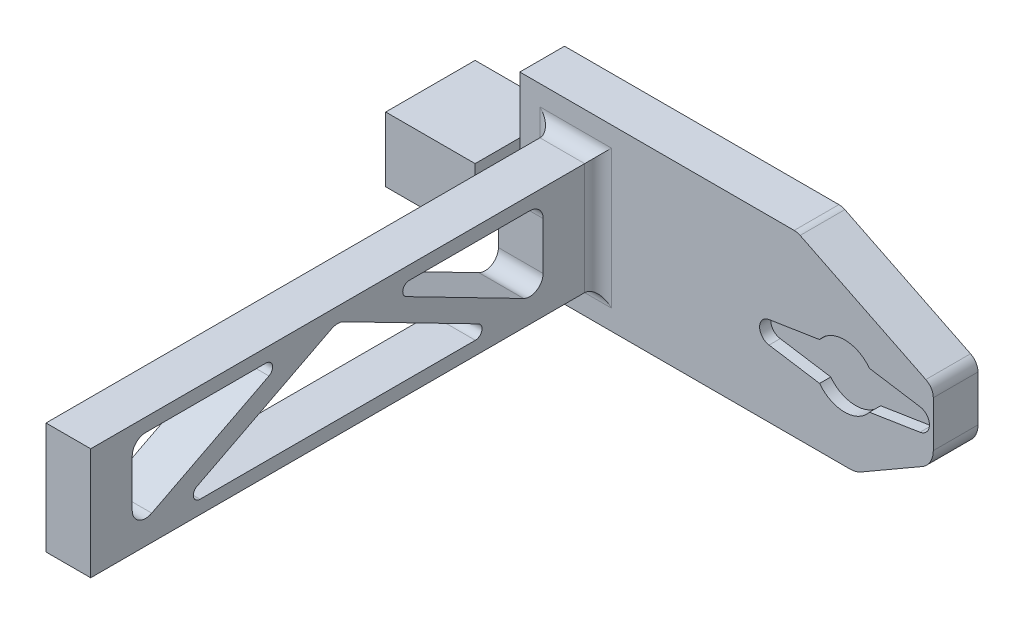
from build123d import *

# Parameters (mm, degrees)
SKETCH3_W            = 42.5
SKETCH3_H            = 15
BOSS_EXTRUDE1_DEPTH  = 10
SKETCH2_R            = 7.012606221
CUT_EXTRUDE1_DEPTH   = 2.5
SKETCH11_W           = 42.5
SKETCH11_H           = 10
BOSS_EXTRUDE5_DEPTH  = 10
SKETCH14_W           = 42.5
SKETCH14_H           = 10
BOSS_EXTRUDE7_DEPTH  = 15
SKETCH20_W           = 10
SKETCH20_H           = 40
BOSS_EXTRUDE10_DEPTH = 50
SKETCH21_W           = 10
SKETCH21_H           = 25
BOSS_EXTRUDE11_DEPTH = 113.5
FILLET1_R            = 3
CHAMFER1_SIZE        = 15
CHAMFER1_SIZE2       = 30.41699103
FILLET2_R            = 3
CHAMFER2_SIZE        = 10
CHAMFER2_SIZE2       = 17.320508076
FILLET3_R            = 5
CUT_EXTRUDE2_DEPTH   = 144.583262507
FILLET4_R            = 3
FILLET5_R            = 1.5
SKETCH25_W           = 10
SKETCH25_H           = 14.5
BOSS_EXTRUDE12_DEPTH = 20
SKETCH26_W           = 20
SKETCH26_H           = 14.5
BOSS_EXTRUDE13_DEPTH = 10


with BuildPart() as part:
    # Sketch3 → Boss-Extrude1 (new body)
    with BuildSketch(Plane.XY):
        with Locations((-1.388845539, 0.05888455)):
            Rectangle(SKETCH3_W, SKETCH3_H)
    extrude(amount=-BOSS_EXTRUDE1_DEPTH)

    # Sketch2 → Cut-Extrude1 (cut)
    with BuildSketch(Plane.XY):
        Circle(SKETCH2_R)
        with BuildLine():
            Line((-16.888114198, 2.469689731), (-3.968626967, 4.5))
            ThreePointArc((-3.968626967, 4.5), (0, 6), (3.968626967, 4.5))
            Line((3.968626967, 4.5), (16.888114198, 2.469689731))
            ThreePointArc((16.888114198, 2.469689731), (19, 0), (16.888114198, -2.469689731))
            Line((16.888114198, -2.469689731), (3.968626967, -4.5))
            ThreePointArc((3.968626967, -4.5), (0, -6), (-3.968626967, -4.5))
            Line((-3.968626967, -4.5), (-16.888114198, -2.469689731))
            ThreePointArc((-16.888114198, -2.469689731), (-19, 0), (-16.888114198, 2.469689731))
        make_face()
    extrude(amount=-CUT_EXTRUDE1_DEPTH, mode=Mode.SUBTRACT)

    # Sketch11 → Boss-Extrude5 (add)
    with BuildSketch(Plane.XZ.offset(7.44111545)):
        with Locations((-1.388845539, -5)):
            Rectangle(SKETCH11_W, SKETCH11_H)
    extrude(amount=BOSS_EXTRUDE5_DEPTH)

    # Sketch14 → Boss-Extrude7 (add)
    with BuildSketch(Plane(origin=(0, 7.55888455, 0), x_dir=(1, 0, 0), z_dir=(0, 1, 0))):
        with Locations((-1.388845539, 5)):
            Rectangle(SKETCH14_W, SKETCH14_H)
    extrude(amount=BOSS_EXTRUDE7_DEPTH)

    # Sketch20 → Boss-Extrude10 (add)
    with BuildSketch(Plane.ZY.offset(22.638845539)):
        with Locations((-5, 2.55888455)):
            Rectangle(SKETCH20_W, SKETCH20_H)
    extrude(amount=BOSS_EXTRUDE10_DEPTH)

    # Sketch21 → Boss-Extrude11 (add)
    with BuildSketch(Plane.XY):
        with Locations((-60.138845539, 2.55888455)):
            Rectangle(SKETCH21_W, SKETCH21_H)
    extrude(amount=BOSS_EXTRUDE11_DEPTH)

    # Fillet1
    fillet1_edges = [part.edges().sort_by_distance(p)[0] for p in [
        (-65.138845539, 2.55888455, 0),
        (-60.138845539, -9.94111545, 0),
        (-55.138845539, 2.55888455, 0),
        (-60.138845539, 15.05888455, 0),
    ]]
    fillet(fillet1_edges, radius=FILLET1_R)

    # Chamfer1
    chamfer1_edges = [part.edges().sort_by_distance(p)[0] for p in [
        (19.861154461, 22.55888455, -5),
    ]]
    chamfer1_side = [part.faces().sort_by_distance(p)[0] for p in [
        (19.861154461, 2.55888455, -5),
    ]]
    chamfer(chamfer1_edges, length=CHAMFER1_SIZE, length2=CHAMFER1_SIZE2, reference=chamfer1_side[0])

    # Fillet2
    fillet2_edges = [part.edges().sort_by_distance(p)[0] for p in [
        (-10.555836569, 22.55888455, -5),
        (19.861154461, 7.55888455, -5),
    ]]
    fillet(fillet2_edges, radius=FILLET2_R)

    # Chamfer2
    chamfer2_edges = [part.edges().sort_by_distance(p)[0] for p in [
        (19.861154461, -17.44111545, -5),
    ]]
    chamfer2_side = [part.faces().sort_by_distance(p)[0] for p in [
        (19.861154461, -5.873875391, -5),
    ]]
    chamfer(chamfer2_edges, length=CHAMFER2_SIZE, length2=CHAMFER2_SIZE2, reference=chamfer2_side[0])

    # Fillet3
    fillet3_edges = [part.edges().sort_by_distance(p)[0] for p in [
        (2.540646385, -17.44111545, -5),
        (19.861154461, -7.44111545, -5),
    ]]
    fillet(fillet3_edges, radius=FILLET3_R)

    # Sketch24 → Cut-Extrude2 (cut, through all)
    with BuildSketch(Plane.ZY.offset(65.138845539)):
        Polygon((58.25, -6.94111545), (95.25, -6.94111545), (58.25, 12.05888455), (21.25, -6.94111545), align=None)
        Polygon((48.39896268, 12.05888455), (12.290027833, -6.483541453), (12.290027833, 12.05888455), align=None)
        Polygon((68.10103732, 12.05888455), (104.209972167, 12.05888455), (104.209972167, -6.483541453), align=None)
    extrude(amount=-CUT_EXTRUDE2_DEPTH, mode=Mode.SUBTRACT)

    # Fillet4
    fillet4_edges = [part.edges().sort_by_distance(p)[0] for p in [
        (-60.138845539, -6.483541453, 104.209972167),
        (-60.138845539, 12.05888455, 104.209972167),
        (-60.138845539, 12.05888455, 12.290027833),
        (-60.138845539, -6.483541453, 12.290027833),
        (-60.138845539, 12.05888455, 58.25),
    ]]
    fillet(fillet4_edges, radius=FILLET4_R)

    # Fillet5
    fillet5_edges = [part.edges().sort_by_distance(p)[0] for p in [
        (-60.138845539, 12.05888455, 68.10103732),
        (-60.138845539, 12.05888455, 48.39896268),
        (-60.138845539, -6.94111545, 21.25),
        (-60.138845539, -6.94111545, 95.25),
    ]]
    fillet(fillet5_edges, radius=FILLET5_R)

    # Sketch25 → Boss-Extrude12 (add)
    with BuildSketch(Plane.ZY.offset(72.638845539)):
        with Locations((-5, 2.55888455)):
            Rectangle(SKETCH25_W, SKETCH25_H)
    extrude(amount=BOSS_EXTRUDE12_DEPTH)

    # Sketch26 → Boss-Extrude13 (add)
    with BuildSketch(Plane.XY):
        with Locations((-82.638845539, 2.55888455)):
            Rectangle(SKETCH26_W, SKETCH26_H)
    extrude(amount=BOSS_EXTRUDE13_DEPTH)


solid = part.part
